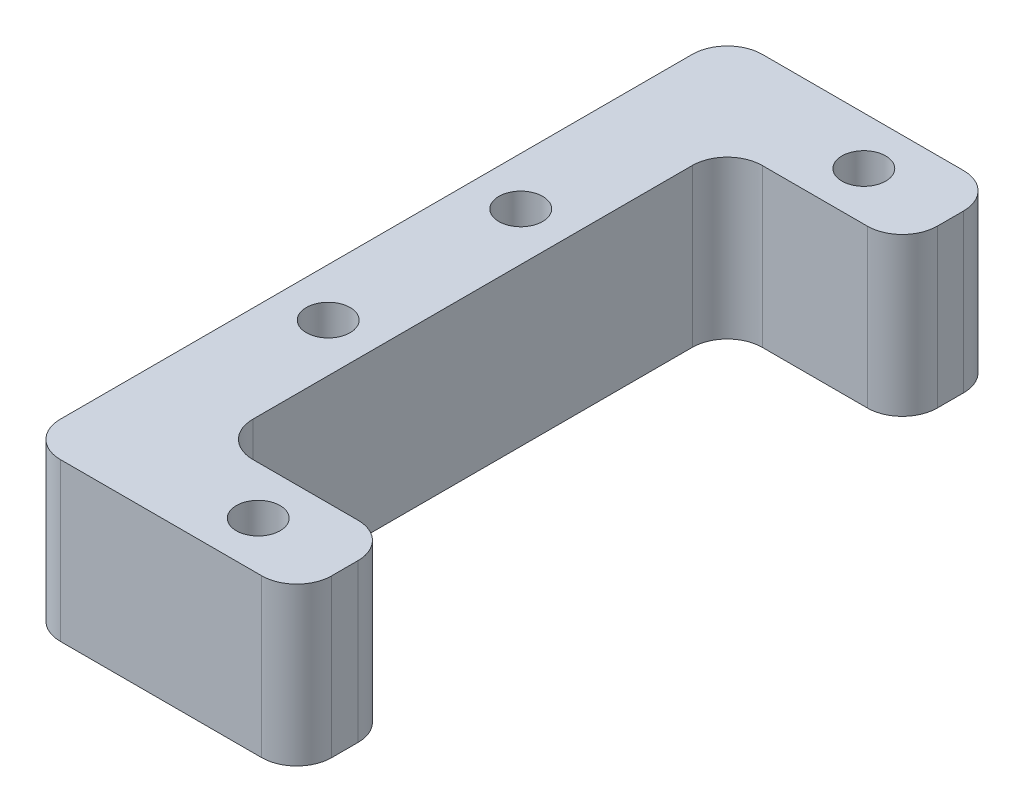
from build123d import *

# Parameters (mm, degrees)
SKETCH1_R           = 1.25
BOSS_EXTRUDE1_DEPTH = 9
FILLET1_R           = 2


with BuildPart() as part:
    # Sketch1 → Boss-Extrude1 (new body)
    with BuildSketch(Plane(origin=(0, 0, 0), x_dir=(1, 0, 0), z_dir=(0, 1, 0))):
        Polygon((0, -20.05), (0, 20.05), (15.5, 20.05), (15.5, 14.55), (5.5, 14.55), (5.5, -14.55), (15.5, -14.55), (15.5, -20.05), align=None)
        with Locations(Location((2.75, 5.5, 0), (0, 0, 270))):
            Circle(SKETCH1_R, mode=Mode.SUBTRACT)
        with Locations(Location((10.55, 17.3, 0), (0, 0, 270))):
            Circle(SKETCH1_R, mode=Mode.SUBTRACT)
        with Locations(Location((10.55, -17.3, 0), (0, 0, 90))):
            Circle(SKETCH1_R, mode=Mode.SUBTRACT)
        with Locations(Location((2.75, -5.5, 0), (0, 0, 90))):
            Circle(SKETCH1_R, mode=Mode.SUBTRACT)
    extrude(amount=BOSS_EXTRUDE1_DEPTH)

    # Fillet1
    fillet1_edges = [part.edges().sort_by_distance(p)[0] for p in [
        (15.5, 4.5, -20.05),
        (15.5, 4.5, -14.55),
        (5.5, 4.5, -14.55),
        (5.5, 4.5, 14.55),
        (15.5, 4.5, 14.55),
        (15.5, 4.5, 20.05),
        (0, 4.5, 20.05),
        (0, 4.5, -20.05),
    ]]
    fillet(fillet1_edges, radius=FILLET1_R)


solid = part.part
